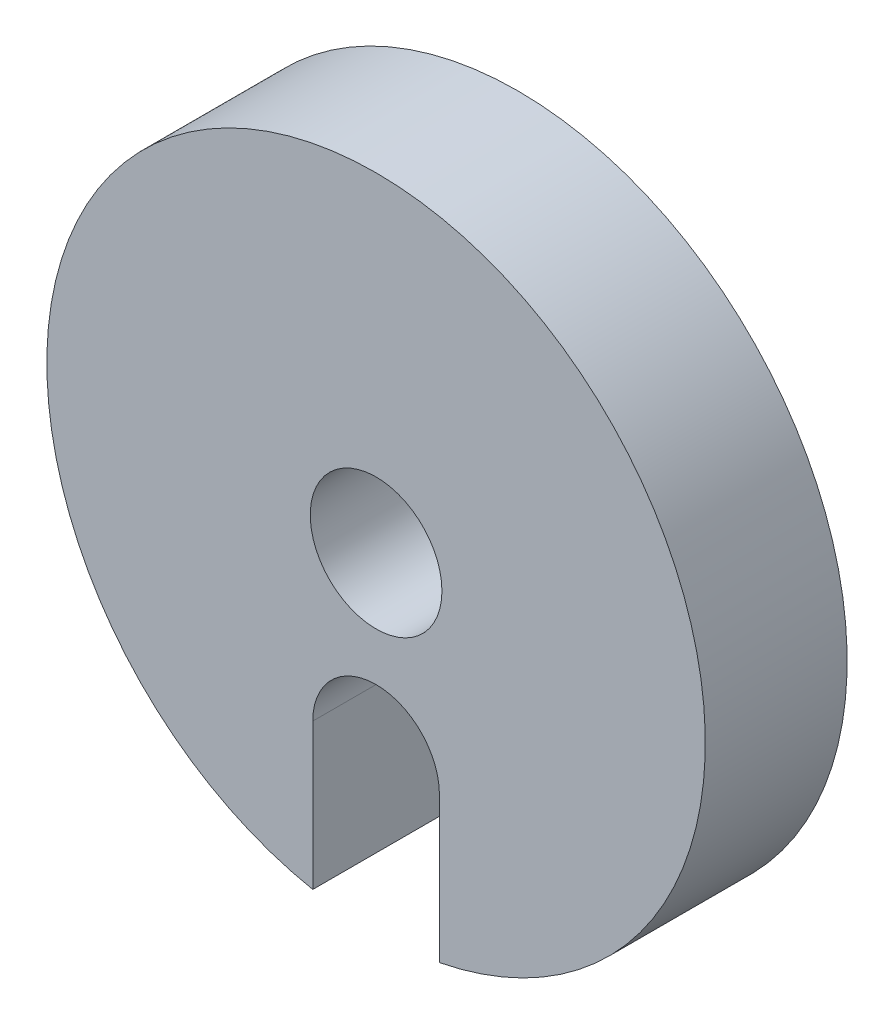
from build123d import *

# Parameters (mm, degrees)
SZKIC1_R                    = 2.6
DODANIE_WYCI_GNI_CIE1_DEPTH = 5.6


with BuildPart() as part:
    # Szkic1 → Dodanie-wyciągnięcie1 (new body)
    with BuildSketch(Plane.XY):
        with BuildLine():
            Line((-2.5, -12.757350822), (-2.5, -7))
            ThreePointArc((-2.5, -7), (0, -4.5), (2.5, -7))
            Line((2.5, -7), (2.5, -12.757350822))
            ThreePointArc((2.5, -12.757350822), (10.03742995, -8.261355821), (13, 0))
            ThreePointArc((13, 0), (-8.261355821, 10.03742995), (-2.5, -12.757350822))
        make_face()
        Circle(SZKIC1_R, mode=Mode.SUBTRACT)
    extrude(amount=DODANIE_WYCI_GNI_CIE1_DEPTH)


solid = part.part
